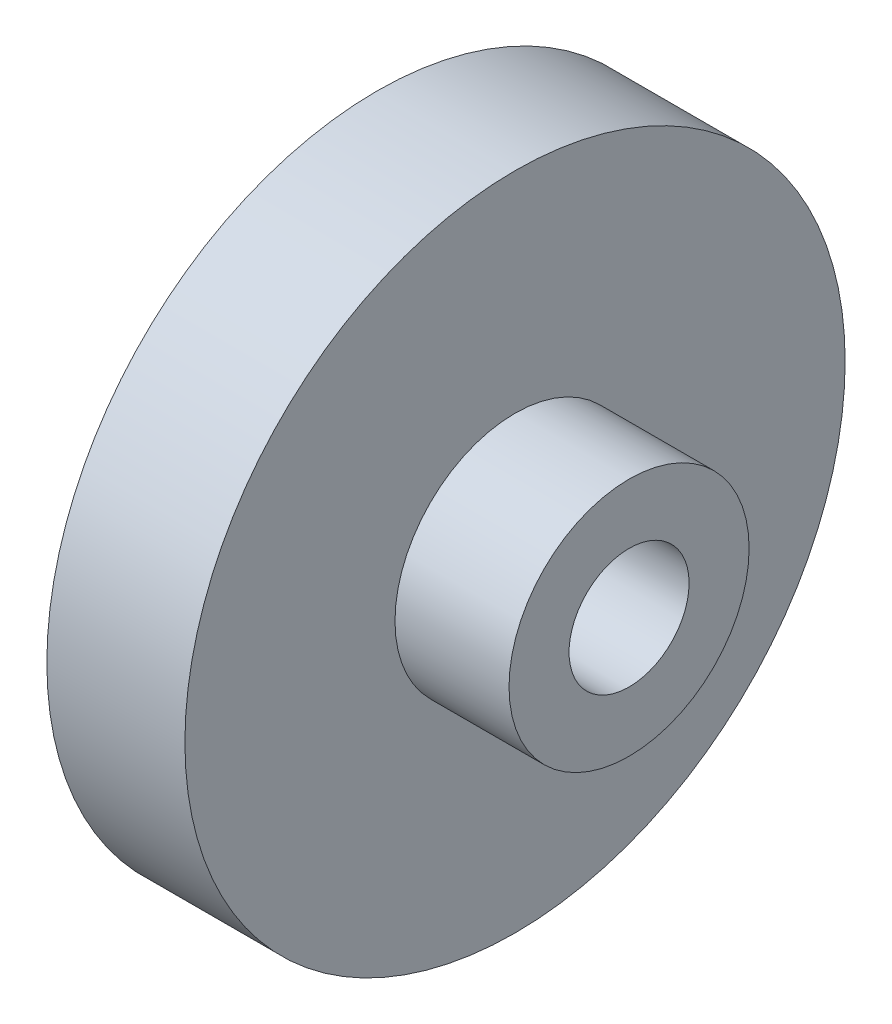
from build123d import *

# Parameters (mm, degrees)
SKETCH_1_R          = 5.5
EXTRUDE_1_DEPTH     = 2.3
SKETCH_2_R          = 2
EXTRUDE_2_DEPTH     = 1.9
SKETCH_3_R          = 1
CUT_EXTRUDE_1_DEPTH = 9.839683252
SKETCH_4_R          = 4.75
CUT_EXTRUDE_2_DEPTH = 1.5


with BuildPart() as part:
    # 草图1 → 凸台-拉伸1 (new body)
    with BuildSketch(Plane(origin=(0, 0, 0), x_dir=(0, 0, -1), z_dir=(1, 0, 0))):
        Circle(SKETCH_1_R)
    extrude(amount=EXTRUDE_1_DEPTH)

    # 草图2 → 凸台-拉伸2 (add)
    with BuildSketch(Plane(origin=(2.3, 0, 0), x_dir=(0, 0, -1), z_dir=(1, 0, 0))):
        with Locations(Location((0, 0, 0), (0, 0, 180))):
            Circle(SKETCH_2_R)
    extrude(amount=EXTRUDE_2_DEPTH)

    # 草图3 → 切除-拉伸1 (cut, through all)
    with BuildSketch(Plane(origin=(4.2, 0, 0), x_dir=(0, 0, -1), z_dir=(1, 0, 0))):
        Circle(SKETCH_3_R)
    extrude(amount=-CUT_EXTRUDE_1_DEPTH, mode=Mode.SUBTRACT)

    # 草图4 → 切除-拉伸2 (cut)
    with BuildSketch(Plane.ZY):
        Circle(SKETCH_4_R)
    extrude(amount=-CUT_EXTRUDE_2_DEPTH, mode=Mode.SUBTRACT)


solid = part.part
